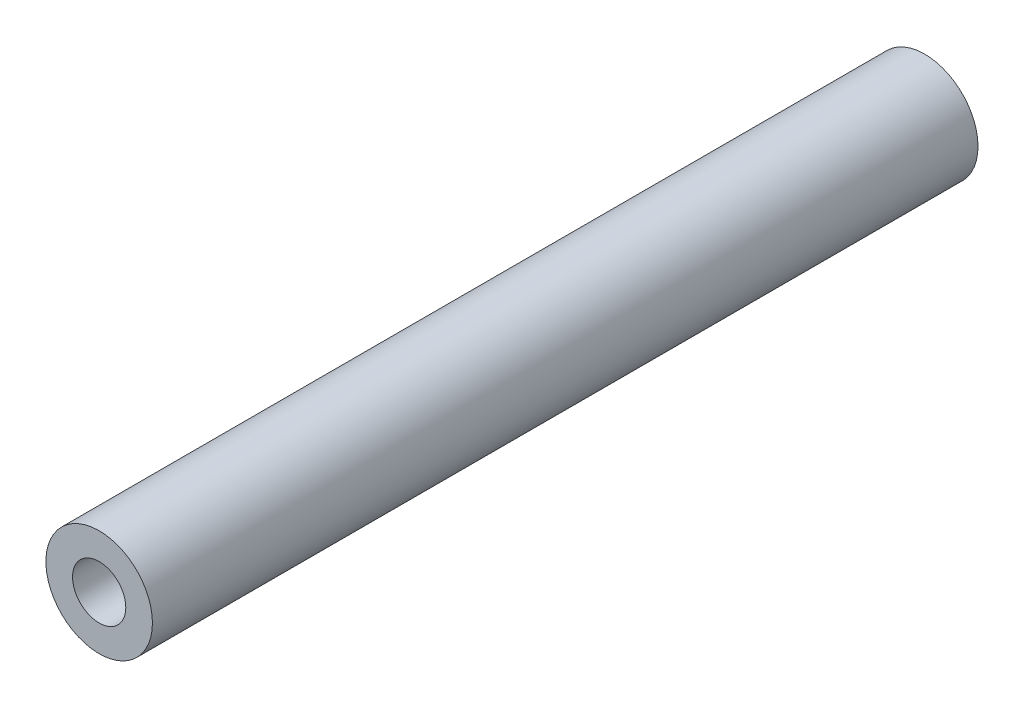
from build123d import *

# Parameters (mm, degrees)
SKETCH1_R           = 6.35
SKETCH1_R_2         = 3.175
BOSS_EXTRUDE1_DEPTH = 98.425


with BuildPart() as part:
    # Sketch1 → Boss-Extrude1 (new body)
    with BuildSketch(Plane.XY):
        Circle(SKETCH1_R)
        Circle(SKETCH1_R_2, mode=Mode.SUBTRACT)
    extrude(amount=BOSS_EXTRUDE1_DEPTH)


solid = part.part
